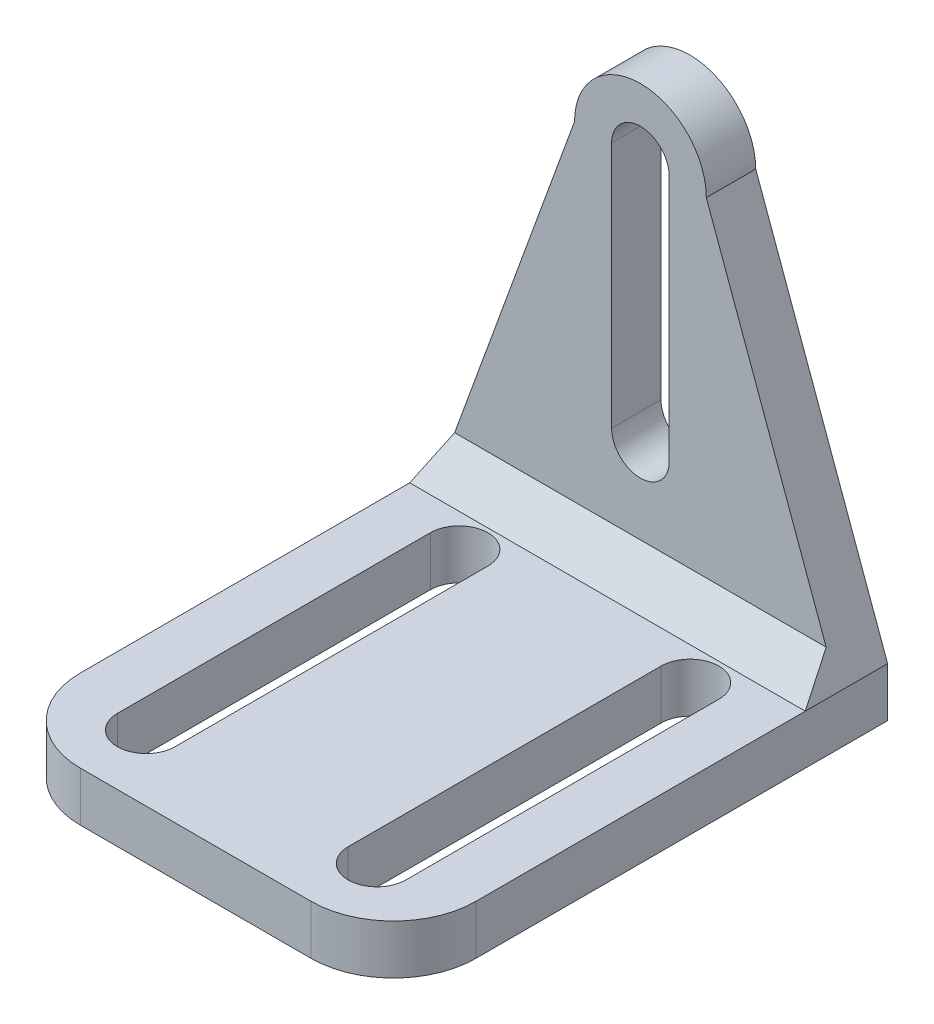
from build123d import *

# Parameters (mm, degrees)
EXTRUDE_1_DEPTH     = 3
SKETCH_1_3_W        = 24.014690308
SKETCH_1_3_H        = 3
EXTRUDE_2_DEPTH     = 30
CUT_EXTRUDE_1_DEPTH = 15
FILLET_1_R          = 5
CHAMFER_1_SIZE      = 2


with BuildPart() as part:
    # 草图1 → 凸台-拉伸1 (new body)
    with BuildSketch(Plane.XY):
        with BuildLine():
            Line((12.007345154, -22), (4, 0))
            ThreePointArc((4, 0), (0, 4), (-4, 0))
            Line((-4, 0), (-12.007345154, -22))
            Line((-12.007345154, -22), (12.007345154, -22))
        make_face()
        with BuildLine():
            Line((-1.75, -15), (-1.75, 0))
            ThreePointArc((-1.75, 0), (0, 1.75), (1.75, 0))
            Line((1.75, 0), (1.75, -15))
            ThreePointArc((1.75, -15), (0, -16.75), (-1.75, -15))
        make_face(mode=Mode.SUBTRACT)
    extrude(amount=EXTRUDE_1_DEPTH)

    # 草图1<3> → 凸台-拉伸2 (add)
    with BuildSketch(Plane.XY):
        with Locations((0, -23.5)):
            Rectangle(SKETCH_1_3_W, SKETCH_1_3_H)
    extrude(amount=EXTRUDE_2_DEPTH)

    # 草图2 → 切除-拉伸1 (cut)
    with BuildSketch(Plane(origin=(0, -22, 0), x_dir=(1, 0, 0), z_dir=(0, 1, 0))):
        with BuildLine():
            ThreePointArc((-5.257345154, -7), (-7.007345154, -5.25), (-8.757345154, -7))
            Line((-8.757345154, -7), (-8.757345154, -26))
            ThreePointArc((-8.757345154, -26), (-7.007345154, -27.75), (-5.257345154, -26))
            Line((-5.257345154, -26), (-5.257345154, -7))
        make_face()
        with BuildLine():
            Line((8.757345154, -26), (8.757345154, -7))
            ThreePointArc((8.757345154, -7), (7.007345154, -5.25), (5.257345154, -7))
            Line((5.257345154, -7), (5.257345154, -26))
            ThreePointArc((5.257345154, -26), (7.007345154, -27.75), (8.757345154, -26))
        make_face()
    extrude(amount=-CUT_EXTRUDE_1_DEPTH, mode=Mode.SUBTRACT)

    # 圆角1
    fillet_1_edges = [part.edges().sort_by_distance(p)[0] for p in [
        (-12.007345154, -23.5, 30),
        (12.007345154, -23.5, 30),
    ]]
    fillet(fillet_1_edges, radius=FILLET_1_R)

    # 倒角1
    chamfer_1_edges = [part.edges().sort_by_distance(p)[0] for p in [
        (0, -22, 3),
    ]]
    chamfer(chamfer_1_edges, length=CHAMFER_1_SIZE)


solid = part.part
